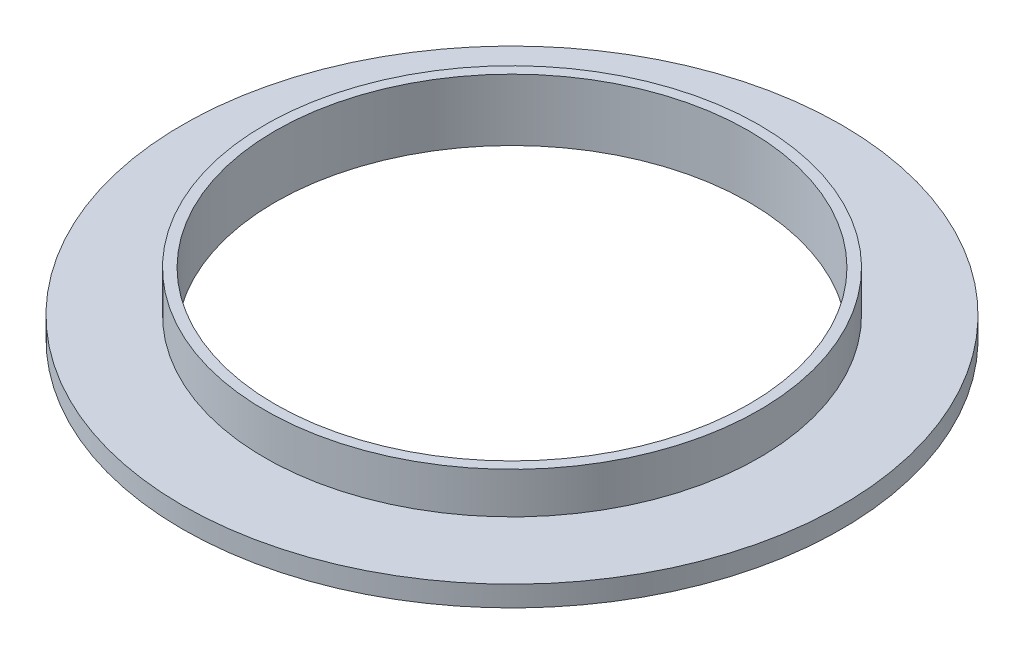
from build123d import *


with BuildPart() as part:
    # Sketch1 → Revolve1 (revolve)
    with BuildSketch(Plane.XY, mode=Mode.PRIVATE) as revolve1_sk:
        Polygon((-11.5, 0), (-16, 0), (-16, 1), (-12, 1), (-12, 3), (-11.5, 3), align=None)
    revolve(revolve1_sk.sketch.rotate(Axis((0, 0, 0), (0, 1, 0)), 270), axis=Axis((0, 0, 0), (0, 1, 0)))


solid = part.part
